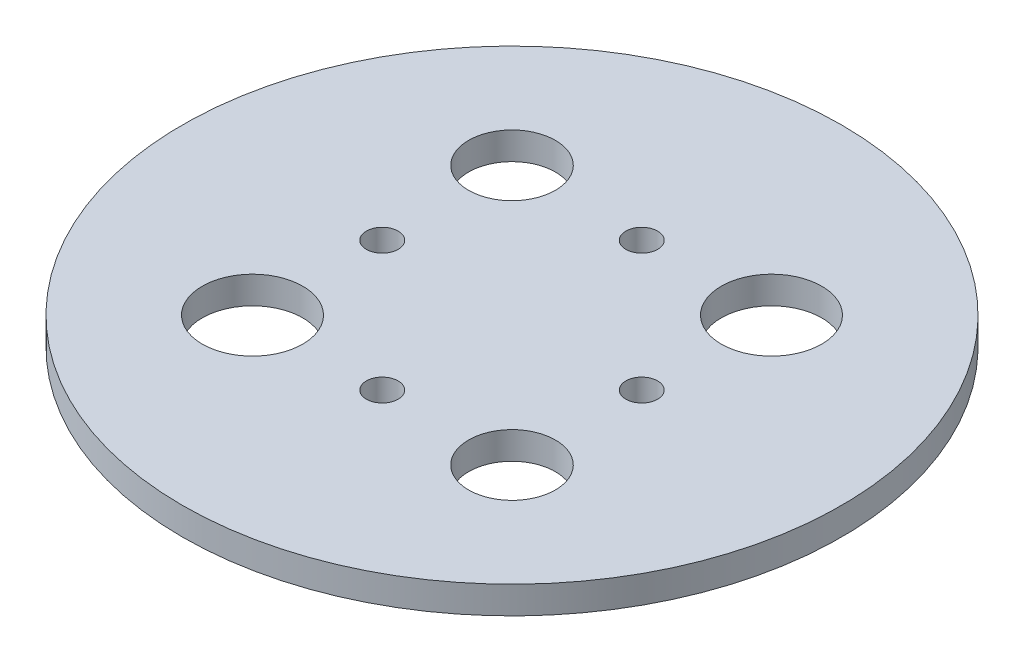
from build123d import *

# Parameters (mm, degrees)
SKETCH1_R               = 76.2
BOSS_EXTRUDE1_DEPTH     = 6.35
CUT_EXTRUDE3_DEPTH      = 108.95
CUT_EXTRUDE3_DEPTH_BACK = 108.95
SKETCH3_R               = 10.025
SKETCH3_R_2             = 3.675
SKETCH3_R_3             = 11.6125


with BuildPart() as part:
    # Sketch1 → Boss-Extrude1 (new body)
    with BuildSketch(Plane(origin=(0, 0, 0), x_dir=(1, 0, 0), z_dir=(0, 1, 0))):
        with Locations(Location((0, 0, 0), (0, 0, 270))):
            Circle(SKETCH1_R)
    extrude(amount=BOSS_EXTRUDE1_DEPTH)

    # Sketch3 → Cut-Extrude3 (cut, two sides: drawn at the far end of the back side and taken through both)
    with BuildSketch(Plane(origin=(0, 0, 0), x_dir=(1, 0, 0), z_dir=(0, 1, 0)).offset(-CUT_EXTRUDE3_DEPTH_BACK)):
        with Locations(Location((-30, 30, 0), (0, 0, 270))):
            Circle(SKETCH3_R)
        with Locations(Location((30, -30, 0), (0, 0, 270))):
            Circle(SKETCH3_R)
        with Locations(Location((0, 30, 0), (0, 0, 270))):
            Circle(SKETCH3_R_2)
        with Locations(Location((30, 0, 0), (0, 0, 270))):
            Circle(SKETCH3_R_2)
        with Locations(Location((0, -30, 0), (0, 0, 270))):
            Circle(SKETCH3_R_2)
        with Locations(Location((-30, 0, 0), (0, 0, 270))):
            Circle(SKETCH3_R_2)
        with Locations(Location((30, 30, 0), (0, 0, 270))):
            Circle(SKETCH3_R_3)
        with Locations(Location((-30, -30, 0), (0, 0, 270))):
            Circle(SKETCH3_R_3)
    extrude(amount=CUT_EXTRUDE3_DEPTH + CUT_EXTRUDE3_DEPTH_BACK, mode=Mode.SUBTRACT)


solid = part.part
